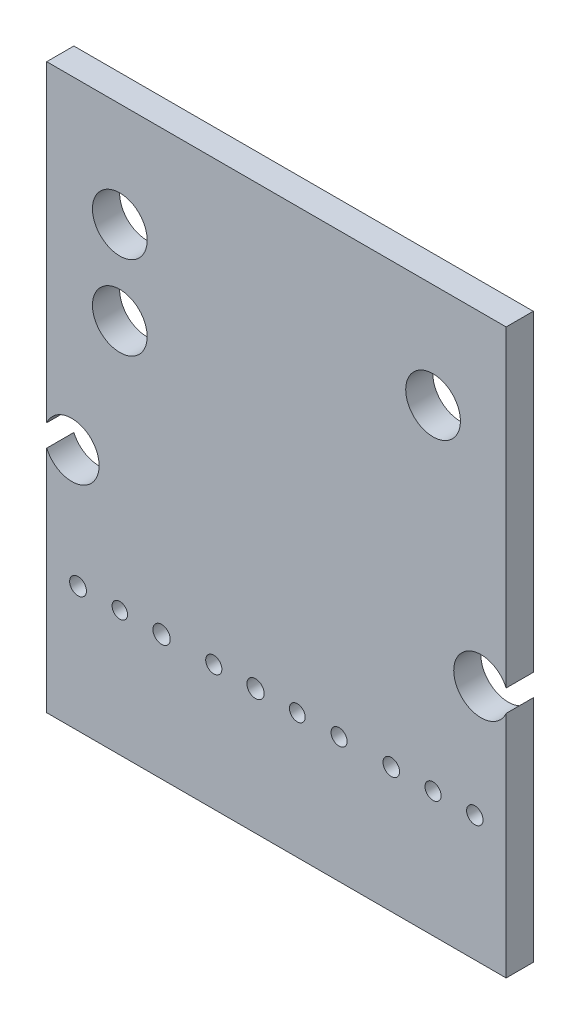
from build123d import *

# Parameters (mm, degrees)
SKETCH2_R           = 1.6637
SKETCH2_R_2         = 0.511037547
SKETCH2_R_3         = 0.469586325
SKETCH2_R_4         = 0.527304242
SKETCH2_R_5         = 0.492462629
SKETCH2_R_6         = 0.523724162
SKETCH2_R_7         = 0.478944742
SKETCH2_R_8         = 0.488742189
SKETCH2_R_9         = 0.503485145
SKETCH2_R_10        = 0.490154406
SKETCH2_R_11        = 0.499999
BOSS_EXTRUDE1_DEPTH = 1.651


with BuildPart() as part:
    # Sketch2 → Boss-Extrude1 (new body)
    with BuildSketch(Plane.XY):
        with BuildLine():
            Line((0, 0), (27.94, 0))
            Line((27.94, 0), (27.94, 13.937675724))
            ThreePointArc((27.94, 13.937675724), (24.7523, 14.605), (27.94, 15.272324276))
            Line((27.94, 15.272324276), (27.94, 34.29))
            Line((27.94, 34.29), (0, 34.29))
            Line((0, 34.29), (0, 15.272324276))
            ThreePointArc((0, 15.272324276), (3.1877, 14.605), (0, 13.937675724))
            Line((0, 13.937675724), (0, 0))
        make_face()
        with Locations((4.445, 22.86)):
            Circle(SKETCH2_R, mode=Mode.SUBTRACT)
        with Locations((4.445, 27.94)):
            Circle(SKETCH2_R, mode=Mode.SUBTRACT)
        with Locations((23.495, 27.94)):
            Circle(SKETCH2_R, mode=Mode.SUBTRACT)
        with Locations((1.905, 7.62)):
            Circle(SKETCH2_R_2, mode=Mode.SUBTRACT)
        with Locations((4.445, 7.62)):
            Circle(SKETCH2_R_3, mode=Mode.SUBTRACT)
        with Locations((6.985, 7.62)):
            Circle(SKETCH2_R_4, mode=Mode.SUBTRACT)
        with Locations((10.16, 7.62)):
            Circle(SKETCH2_R_5, mode=Mode.SUBTRACT)
        with Locations((12.7, 7.62)):
            Circle(SKETCH2_R_6, mode=Mode.SUBTRACT)
        with Locations((15.24, 7.62)):
            Circle(SKETCH2_R_7, mode=Mode.SUBTRACT)
        with Locations((17.78, 7.62)):
            Circle(SKETCH2_R_8, mode=Mode.SUBTRACT)
        with Locations((20.955, 7.62)):
            Circle(SKETCH2_R_9, mode=Mode.SUBTRACT)
        with Locations((23.495, 7.62)):
            Circle(SKETCH2_R_10, mode=Mode.SUBTRACT)
        with Locations((26.035, 7.62)):
            Circle(SKETCH2_R_11, mode=Mode.SUBTRACT)
    extrude(amount=BOSS_EXTRUDE1_DEPTH)


solid = part.part
